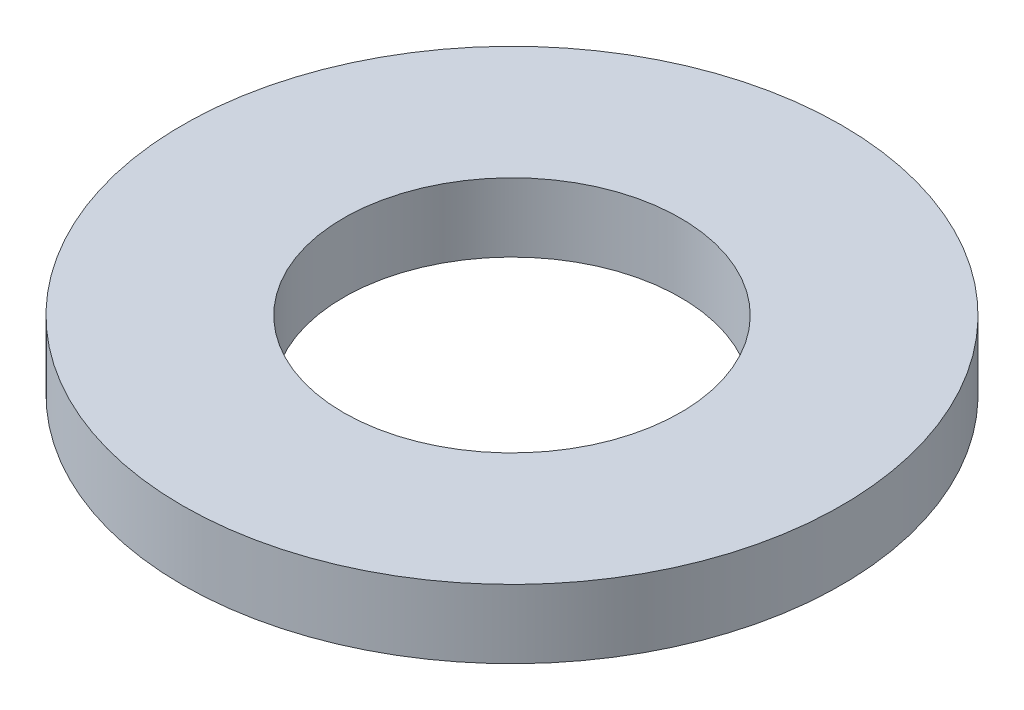
from build123d import *

# Parameters (mm, degrees)
SKETCH_1_R      = 12
SKETCH_1_R_2    = 6.135
EXTRUDE_1_DEPTH = 2.5


with BuildPart() as part:
    # Эскиз1 → Бобышка-Вытянуть1 (new body)
    with BuildSketch(Plane(origin=(0, 0, 0), x_dir=(1, 0, 0), z_dir=(0, 1, 0))):
        with Locations(Location((0, 0, 0), (0, 0, 270))):
            Circle(SKETCH_1_R)
        with Locations(Location((0, 0, 0), (0, 0, 270))):
            Circle(SKETCH_1_R_2, mode=Mode.SUBTRACT)
    extrude(amount=EXTRUDE_1_DEPTH)


solid = part.part
